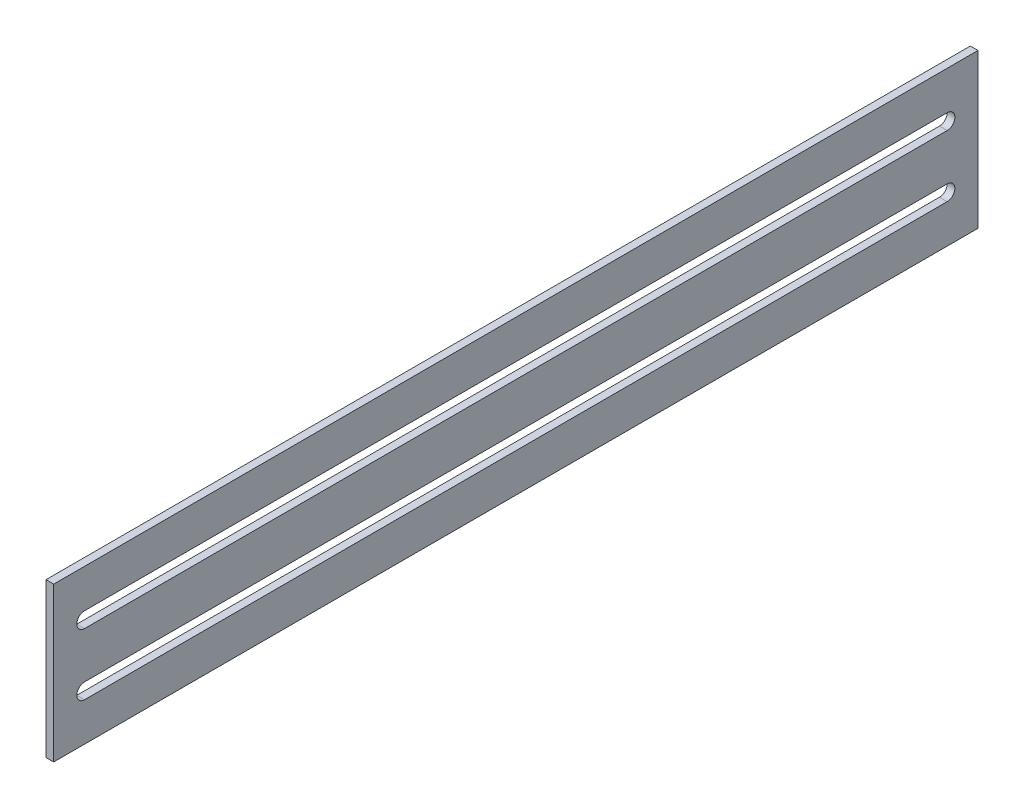
from build123d import *

# Parameters (mm, degrees)
SKETCH1_W       = 381
SKETCH1_H       = 63.5
OUTER_CUT_DEPTH = 1.5875
SLOTS_DEPTH     = 194.153806913


with BuildPart() as part:
    # Sketch1 → Outer Cut (new, symmetric)
    with BuildSketch(Plane(origin=(0, 0, 0), x_dir=(0, 0, -1), z_dir=(1, 0, 0))):
        Rectangle(SKETCH1_W, SKETCH1_H)
    extrude(amount=OUTER_CUT_DEPTH, both=True)

    # Sketch2 → Slots (cut, through all)
    with BuildSketch(Plane(origin=(1.5875, 0, 0), x_dir=(0, 0, -1), z_dir=(1, 0, 0))):
        with BuildLine():
            Line((-177.8, 15.875), (177.8, 15.875))
            ThreePointArc((177.8, 15.875), (180.975, 12.7), (177.8, 9.525))
            Line((177.8, 9.525), (-177.8, 9.525))
            ThreePointArc((-177.8, 9.525), (-180.975, 12.7), (-177.8, 15.875))
        make_face()
        with BuildLine():
            Line((-177.8, -15.875), (177.8, -15.875))
            ThreePointArc((177.8, -15.875), (180.975, -12.7), (177.8, -9.525))
            Line((177.8, -9.525), (-177.8, -9.525))
            ThreePointArc((-177.8, -9.525), (-180.975, -12.7), (-177.8, -15.875))
        make_face()
    extrude(amount=-SLOTS_DEPTH, mode=Mode.SUBTRACT)


solid = part.part
